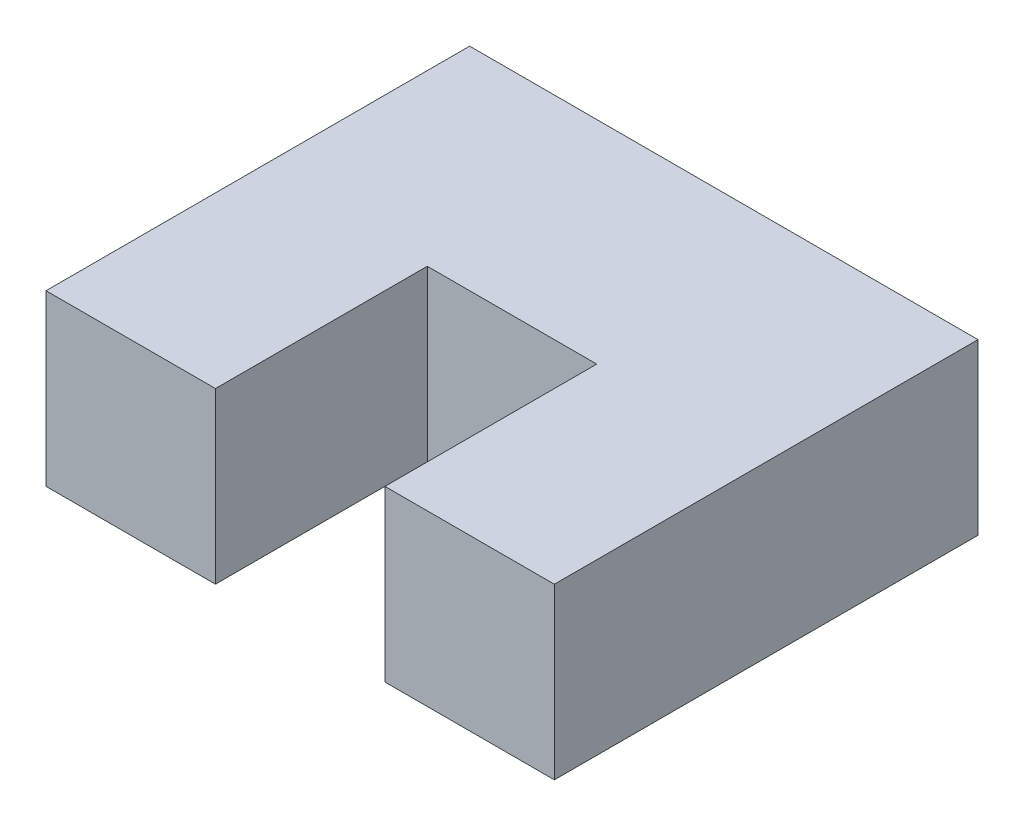
from build123d import *

# Parameters (mm, degrees)
CROQUIS1_W              = 60
CROQUIS1_H              = 20
SALIENTE_EXTRUIR1_DEPTH = 30
CROQUIS2_W              = 20
CROQUIS2_H              = 20
CORTAR_EXTRUIR1_DEPTH   = 5
CROQUIS4_W              = 20
CROQUIS4_H              = 20
SALIENTE_EXTRUIR2_DEPTH = 20


with BuildPart() as part:
    # Croquis1 → Saliente-Extruir1 (new body)
    with BuildSketch(Plane.XY):
        Rectangle(CROQUIS1_W, CROQUIS1_H)
    extrude(amount=SALIENTE_EXTRUIR1_DEPTH)

    # Croquis2 → Cortar-Extruir1 (cut)
    with BuildSketch(Plane.XY.offset(30)):
        Rectangle(CROQUIS2_W, CROQUIS2_H)
    extrude(amount=-CORTAR_EXTRUIR1_DEPTH, mode=Mode.SUBTRACT)

    # Croquis4 → Saliente-Extruir2 (add)
    with BuildSketch(Plane.XY.offset(30)):
        with Locations((-20, 0)):
            Rectangle(CROQUIS4_W, CROQUIS4_H)
        with Locations((20, 0)):
            Rectangle(CROQUIS4_W, CROQUIS4_H)
    extrude(amount=SALIENTE_EXTRUIR2_DEPTH)


solid = part.part
